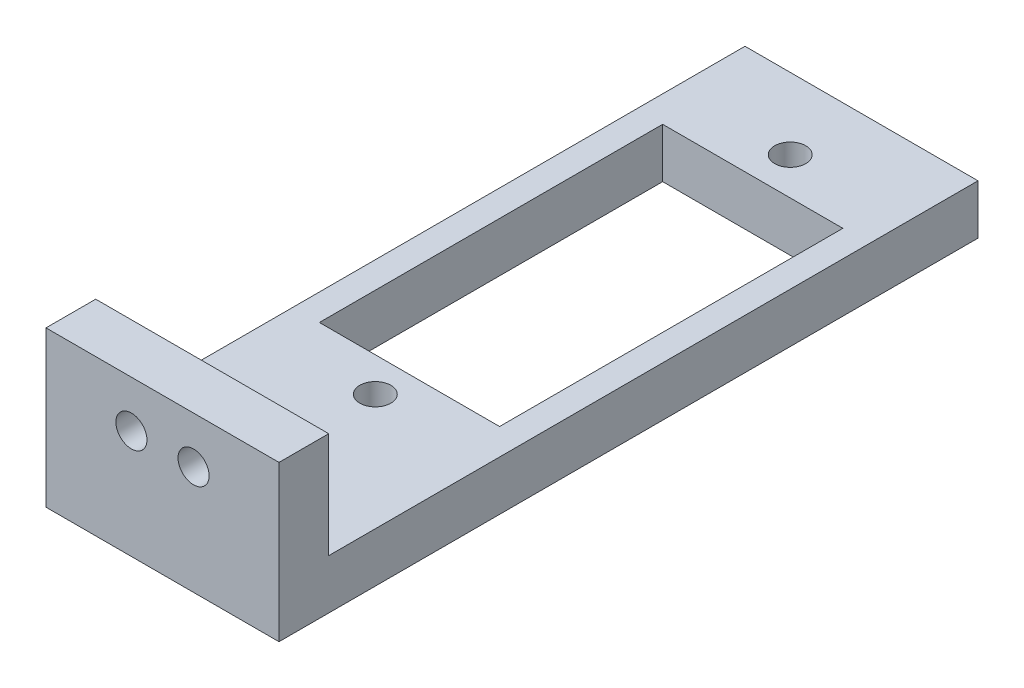
from build123d import *

# Parameters (mm, degrees)
SKETCH1_W           = 15
SKETCH1_H           = 45
BOSS_EXTRUDE1_DEPTH = 10
SKETCH4_W           = 15
SKETCH4_H           = 6.8
CUT_EXTRUDE2_DEPTH  = 41.8
SKETCH5_R           = 1
CUT_EXTRUDE3_DEPTH  = 47.703854231
SKETCH6_R           = 1
SKETCH6_W           = 11.6
SKETCH6_H           = 22.1
CUT_EXTRUDE4_DEPTH  = 25.67265693


with BuildPart() as part:
    # Sketch1 → Boss-Extrude1 (new body)
    with BuildSketch(Plane(origin=(0, 0, 0), x_dir=(1, 0, 0), z_dir=(0, 1, 0))):
        Rectangle(SKETCH1_W, SKETCH1_H)
    extrude(amount=BOSS_EXTRUDE1_DEPTH)

    # Sketch4 → Cut-Extrude2 (cut)
    with BuildSketch(Plane(origin=(0, 0, -22.5), x_dir=(-1, 0, 0), z_dir=(0, 0, -1))):
        with Locations((0, 6.6)):
            Rectangle(SKETCH4_W, SKETCH4_H)
    extrude(amount=-CUT_EXTRUDE2_DEPTH, mode=Mode.SUBTRACT)

    # Sketch5 → Cut-Extrude3 (cut, through all)
    with BuildSketch(Plane.XY.offset(22.5)):
        with Locations((-2, 7)):
            Circle(SKETCH5_R)
        with Locations((2, 7)):
            Circle(SKETCH5_R)
    extrude(amount=-CUT_EXTRUDE3_DEPTH, mode=Mode.SUBTRACT)

    # Sketch6 → Cut-Extrude4 (cut, through all)
    with BuildSketch(Plane(origin=(0, 3.2, 0), x_dir=(1, 0, 0), z_dir=(0, 1, 0))):
        with Locations(Location((0, -8.8, 0), (0, 0, 270))):
            Circle(SKETCH6_R)
        with Locations(Location((0, 17.91, 0), (0, 0, 270))):
            Circle(SKETCH6_R)
        with Locations((0, 4.45)):
            Rectangle(SKETCH6_W, SKETCH6_H)
    extrude(amount=-CUT_EXTRUDE4_DEPTH, mode=Mode.SUBTRACT)


solid = part.part
